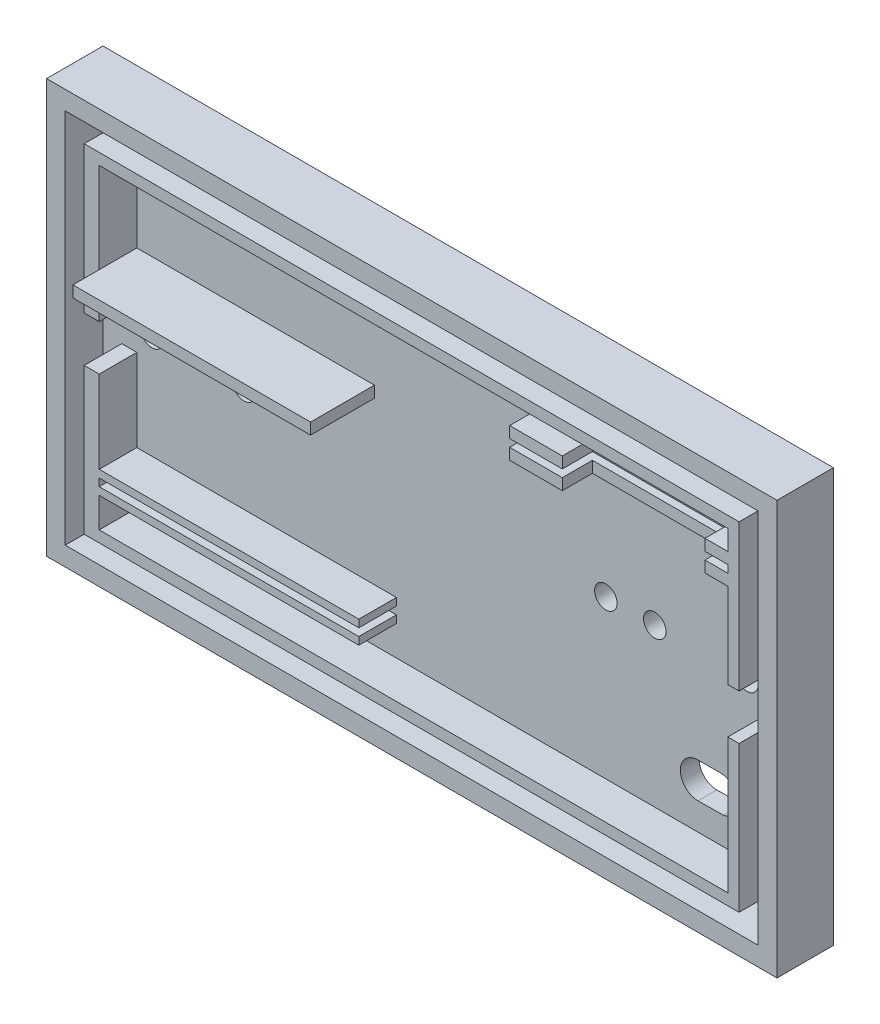
from build123d import *

# Parameters (mm, degrees)
ESBO_O1_W                = 174.2
ESBO_O1_H                = 90
RESSALTO_EXTRUS_O1_DEPTH = 10
ESBO_O2_W                = 194.2
ESBO_O2_H                = 110
ESBO_O2_W_2              = 184.2
ESBO_O2_H_2              = 100
RESSALTO_EXTRUS_O2_DEPTH = 20
ESBO_O3_W                = 194.2
ESBO_O3_H                = 110
RESSALTO_EXTRUS_O3_DEPTH = 5
ESBO_O5_R                = 3
CORTE_EXTRUS_O1_DEPTH    = 20
ESBO_O6_W                = 63.181422492
ESBO_O6_H                = 3
RESSALTO_EXTRUS_O4_DEPTH = 17
ESBO_O7_W                = 70
ESBO_O7_H                = 2
ESBO_O7_W_2              = 58
ESBO_O7_H_2              = 3
RESSALTO_EXTRUS_O5_DEPTH = 10
ESBO_O10_W               = 37.92
ESBO_O10_H               = 15
CORTE_EXTRUS_O2_DEPTH    = 75
CORTE_EXTRUS_O3_DEPTH    = 20
ESBO_O13_W               = 184.2
ESBO_O13_H               = 100
ESBO_O13_W_2             = 174.2
ESBO_O13_H_2             = 90
RESSALTO_EXTRUS_O6_DEPTH = 10
RESSALTO_EXTRUS_O7_DEPTH = 10
ESBO_O17_W               = 194.2
ESBO_O17_H               = 10
CORTE_EXTRUS_O5_DEPTH    = 200


with BuildPart() as part:
    # Esboço1 → Ressalto-extrusão1 (new body)
    with BuildSketch(Plane.XY):
        with Locations((14.940102366, -12.259532062)):
            Rectangle(ESBO_O1_W, ESBO_O1_H)
    extrude(amount=RESSALTO_EXTRUS_O1_DEPTH)



with BuildPart() as body_2:
    # Esboço2 → Ressalto-extrusão2 (new body)
    with BuildSketch(Plane(origin=(0, 0, 0), x_dir=(-1, 0, 0), z_dir=(0, 0, -1))):
        with Locations((-14.940102366, -12.259532062)):
            Rectangle(ESBO_O2_W, ESBO_O2_H)
        with Locations((-14.900102366, -12.219532062)):
            Rectangle(ESBO_O2_W_2, ESBO_O2_H_2, mode=Mode.SUBTRACT)
    extrude(amount=-RESSALTO_EXTRUS_O2_DEPTH)


with BuildPart() as part_1:
    add(part.part)

    add(body_2.part)  # Ressalto-extrusão3 merges body 2
    # Esboço3 → Ressalto-extrusão3 (add)
    with BuildSketch(Plane(origin=(0, 0, 0), x_dir=(-1, 0, 0), z_dir=(0, 0, -1))):
        with Locations((-14.940102366, -12.259532062)):
            Rectangle(ESBO_O3_W, ESBO_O3_H)
    extrude(amount=RESSALTO_EXTRUS_O3_DEPTH)

    # Esboço5 → Corte-extrusão1 (cut)
    with BuildSketch(Plane.XY.offset(10)):
        with Locations((-64.159897634, -12.259532062)):
            Circle(ESBO_O5_R)
        with Locations((94.040102366, -12.259532062)):
            Circle(ESBO_O5_R)
        with Locations((-39.659897634, -12.259532062)):
            Circle(ESBO_O5_R)
        with Locations((69.540102366, -12.259532062)):
            Circle(ESBO_O5_R)
        with Locations((56.540102366, -12.259532062)):
            Circle(ESBO_O5_R)
    extrude(amount=-CORTE_EXTRUS_O1_DEPTH, mode=Mode.SUBTRACT)

    # Esboço6 → Ressalto-extrusão4 (add)
    with BuildSketch(Plane.XY.offset(10)):
        with Locations((-36.569186388, 4.240467938)):
            Rectangle(ESBO_O6_W, ESBO_O6_H)
    extrude(amount=RESSALTO_EXTRUS_O4_DEPTH)

    # Esboço7 → Ressalto-extrusão5 (add)
    with BuildSketch(Plane.XY.offset(10)):
        with Locations((-34.149897634, -41.229786606)):
            Rectangle(ESBO_O7_W, ESBO_O7_H)
        with Locations((-34.149897634, -45.229786606)):
            Rectangle(ESBO_O7_W, ESBO_O7_H)
        with Locations((69.960102366, 17.908396253)):
            Rectangle(ESBO_O7_W_2, ESBO_O7_H_2)
        with Locations((69.960102366, 22.908396253)):
            Rectangle(ESBO_O7_W_2, ESBO_O7_H_2)
    extrude(amount=RESSALTO_EXTRUS_O5_DEPTH)

    # Esboço10 → Corte-extrusão2 (cut)
    with BuildSketch(Plane.XZ.offset(46.229786606)):
        with Locations((73.920102366, 19.5)):
            Rectangle(ESBO_O10_W, ESBO_O10_H)
    extrude(amount=-CORTE_EXTRUS_O2_DEPTH, mode=Mode.SUBTRACT)

    # Esboço11 → Corte-extrusão3 (cut)
    with BuildSketch(Plane.XY.offset(10)):
        with BuildLine():
            Line((81.040102366, -37.559532062), (87.040102366, -37.559532062))
            ThreePointArc((87.040102366, -37.559532062), (91.723412608, -41.863798339), (87.828759302, -46.89289156))
            Line((87.828759302, -46.89289156), (81.040102366, -46.959532062))
            ThreePointArc((81.040102366, -46.959532062), (76.340102366, -42.259532062), (81.040102366, -37.559532062))
        make_face()
    extrude(amount=-CORTE_EXTRUS_O3_DEPTH, mode=Mode.SUBTRACT)

    # Esboço13 → Ressalto-extrusão6 (add)
    with BuildSketch(Plane.XY):
        with Locations((14.900102366, -12.219532062)):
            Rectangle(ESBO_O13_W, ESBO_O13_H)
        with Locations((14.940102366, -12.259532062)):
            Rectangle(ESBO_O13_W_2, ESBO_O13_H_2, mode=Mode.SUBTRACT)
    extrude(amount=RESSALTO_EXTRUS_O6_DEPTH)

    # Esboço14 → Ressalto-extrusão7 (add)
    with BuildSketch(Plane.XY.offset(10)):
        Polygon((101.960102366, -57.179532062), (-72.159897634, -57.179532062), (-72.159897634, -18.299532062), (-68.159897634, -18.299532062), (-68.159897634, -54.179532062), (98.960102366, -54.179532062), (98.960102366, -18.299532062), (101.960102366, -18.299532062), align=None)
        Polygon((101.960102366, 32.740467938), (-72.159897634, 32.740467938), (-72.159897634, -6.219532062), (-68.159897634, -6.219532062), (-68.159897634, 29.740467938), (98.960102366, 29.740467938), (98.960102366, -6.219532062), (101.960102366, -6.219532062), align=None)
    extrude(amount=RESSALTO_EXTRUS_O7_DEPTH)

    # Esboço17 → Corte-extrusão5 (cut)
    with BuildSketch(Plane.XZ.offset(67.259532062)):
        with Locations((14.940102366, 0)):
            Rectangle(ESBO_O17_W, ESBO_O17_H)
    extrude(amount=-CORTE_EXTRUS_O5_DEPTH, mode=Mode.SUBTRACT)


solid = part_1.part
